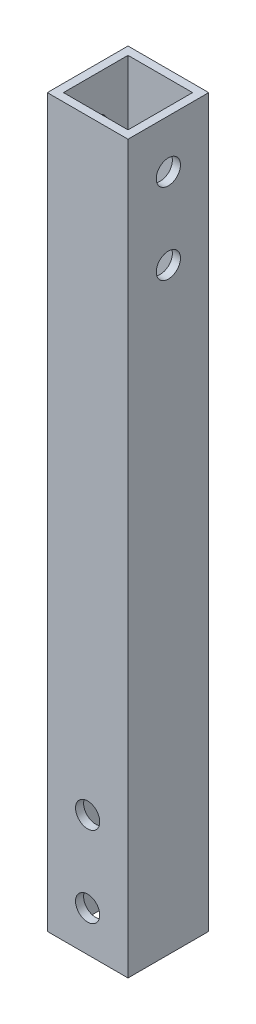
from build123d import *

# Parameters (mm, degrees)
SKETCH_1_W          = 10
SKETCH_1_H          = 10
SKETCH_1_W_2        = 8
SKETCH_1_H_2        = 8
EXTRUDE_1_DEPTH     = 90
SKETCH_2_R          = 1.5
CUT_EXTRUDE_1_DEPTH = 30
SKETCH_3_R          = 1.5
CUT_EXTRUDE_2_DEPTH = 30


with BuildPart() as part:
    # 草图1 → 凸台-拉伸1 (new body)
    with BuildSketch(Plane(origin=(0, 0, 0), x_dir=(1, 0, 0), z_dir=(0, 1, 0))):
        Rectangle(SKETCH_1_W, SKETCH_1_H)
        Rectangle(SKETCH_1_W_2, SKETCH_1_H_2, mode=Mode.SUBTRACT)
    extrude(amount=EXTRUDE_1_DEPTH)

    # 草图2 → 切除-拉伸1 (cut)
    with BuildSketch(Plane.ZY.offset(5)):
        with Locations((0, 84)):
            Circle(SKETCH_2_R)
        with Locations((0, 74)):
            Circle(SKETCH_2_R)
    extrude(amount=-CUT_EXTRUDE_1_DEPTH, mode=Mode.SUBTRACT)

    # 草图3 → 切除-拉伸2 (cut)
    with BuildSketch(Plane.XY.offset(5)):
        with Locations((0, 5)):
            Circle(SKETCH_3_R)
        with Locations((0, 15)):
            Circle(SKETCH_3_R)
    extrude(amount=-CUT_EXTRUDE_2_DEPTH, mode=Mode.SUBTRACT)


solid = part.part
